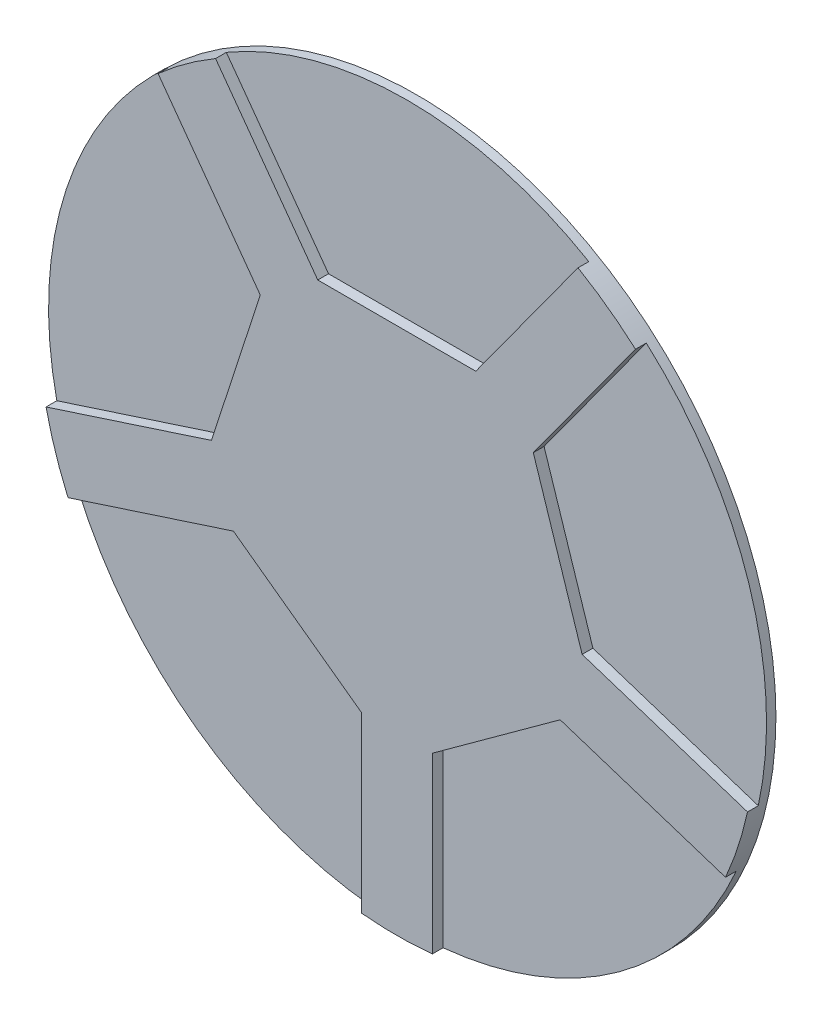
from build123d import *

# Parameters (mm, degrees)
SKETCH1_R           = 213.710950615
BOSS_EXTRUDE1_DEPTH = 12
CUT_EXTRUDE1_START  = -6.405003169
CUT_EXTRUDE1_DEPTH  = 6.405003169
CIRPATTERN1_COUNT   = 5


with BuildPart() as part:
    # Sketch1 → Boss-Extrude1 (new body)
    with BuildSketch(Plane.XY):
        Circle(SKETCH1_R)
    extrude(amount=BOSS_EXTRUDE1_DEPTH)

    # Sketch2 → Cut-Extrude1 (cut)
    with BuildSketch(Plane.XY.offset(12).offset(CUT_EXTRUDE1_START)):
        with BuildLine():
            Line((-47.040542179, 100.736288781), (47.040542179, 100.736288781))
            Line((47.040542179, 100.736288781), (107.884686522, 184.48106902))
            ThreePointArc((107.884686522, 184.48106902), (0, 213.710950615), (-107.884686522, 184.48106902))
            Line((-107.884686522, 184.48106902), (-47.040542179, 100.736288781))
        make_face()
    cut_extrude1 = extrude(amount=CUT_EXTRUDE1_DEPTH, mode=Mode.SUBTRACT)

    # CirPattern1: Cut-Extrude1 ×5 about axis
    cirpattern1_axis = Axis((0, 0, 0), (0, 0, 1))
    for i in range(1, CIRPATTERN1_COUNT):
        add(cut_extrude1.rotate(cirpattern1_axis, i * 360 / CIRPATTERN1_COUNT), mode=Mode.SUBTRACT)


solid = part.part
